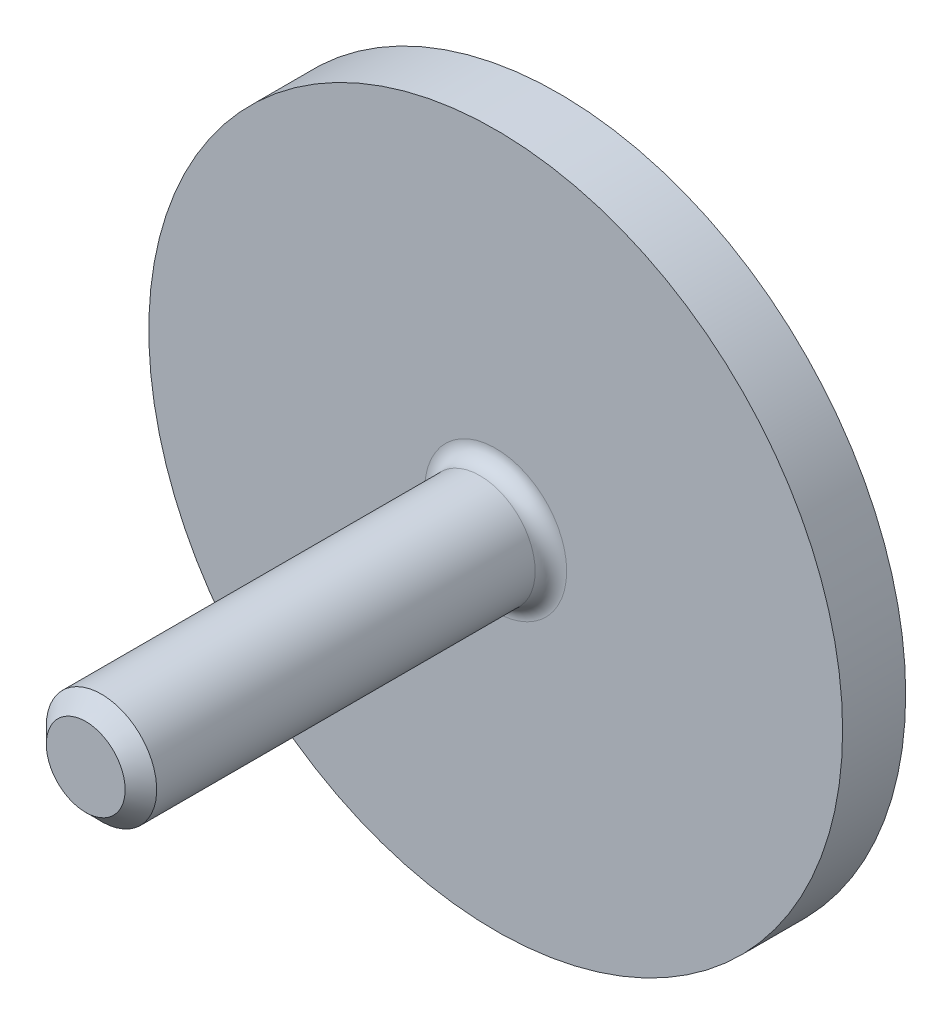
from build123d import *

# Parameters (mm, degrees)
ESQUISSE1_R          = 11
BASE_EXTRUSION_DEPTH = 2
ESQUISSE3_R          = 1.75
BOSS_EXTRU_1_DEPTH   = 13
CHANFREIN1_SIZE      = 0.5
CONG_1_R             = 0.5


with BuildPart() as part:
    # Esquisse1 → Base-Extrusion (new body)
    with BuildSketch(Plane.XY):
        Circle(ESQUISSE1_R)
    extrude(amount=BASE_EXTRUSION_DEPTH)

    # Esquisse3 → Boss.-Extru.1 (add)
    with BuildSketch(Plane.XY.offset(2)):
        with Locations(Location((0, 0, 0), (0, 0, 180))):
            Circle(ESQUISSE3_R)
    extrude(amount=BOSS_EXTRU_1_DEPTH)

    # Chanfrein1
    chanfrein1_edges = [part.edges().sort_by_distance(p)[0] for p in [
        (1.75, 0, 15),
    ]]
    chamfer(chanfrein1_edges, length=CHANFREIN1_SIZE)

    # Congé1
    cong_1_edges = [part.edges().sort_by_distance(p)[0] for p in [
        (1.75, 0, 2),
    ]]
    fillet(cong_1_edges, radius=CONG_1_R)


solid = part.part
